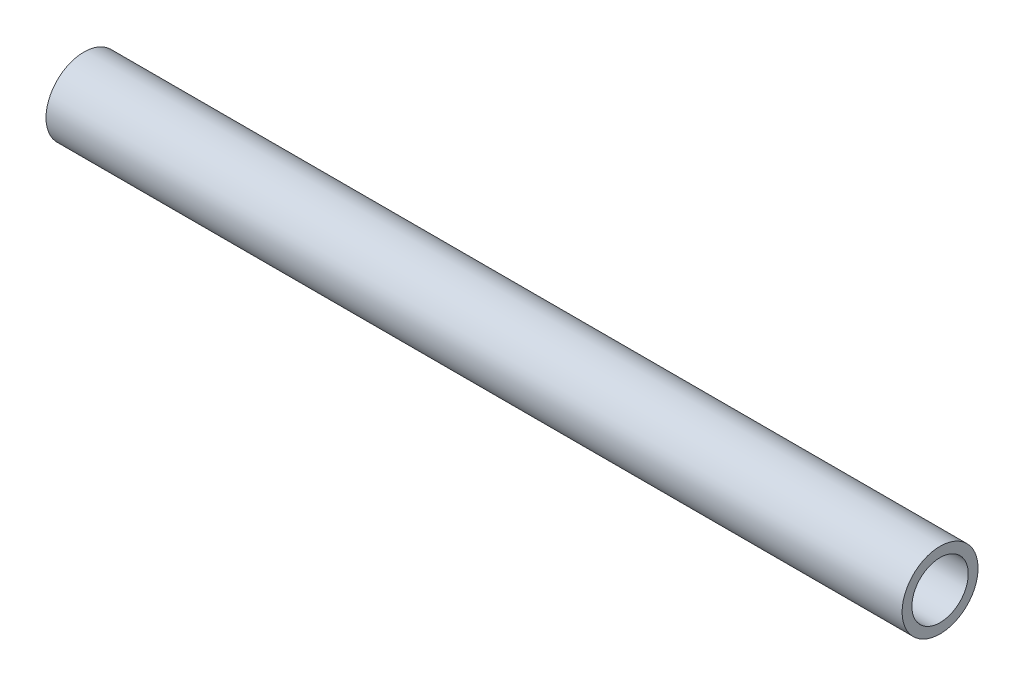
from build123d import *

# Parameters (mm, degrees)
CROQUIS1_R              = 10.65
CROQUIS1_R_2            = 7.9
SALIENTE_EXTRUIR1_DEPTH = 240


with BuildPart() as part:
    # Croquis1 → Saliente-Extruir1 (new body)
    with BuildSketch(Plane(origin=(0, 0, 0), x_dir=(0, 0, -1), z_dir=(1, 0, 0))):
        with Locations(Location((0, 0, 0), (0, 0, 180))):
            Circle(CROQUIS1_R)
        with Locations(Location((0, 0, 0), (0, 0, 180))):
            Circle(CROQUIS1_R_2, mode=Mode.SUBTRACT)
    extrude(amount=SALIENTE_EXTRUIR1_DEPTH)


solid = part.part
